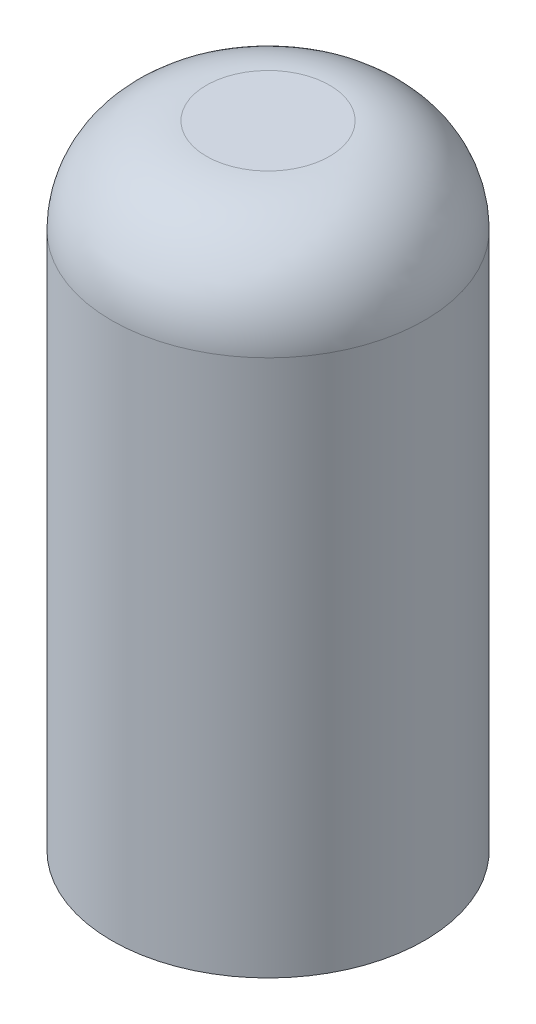
from build123d import *

# Parameters (mm, degrees)
SKETCH1_R           = 4.95
BOSS_EXTRUDE1_DEPTH = 20
FILLET1_R           = 3


with BuildPart() as part:
    # Sketch1 → Boss-Extrude1 (new body)
    with BuildSketch(Plane(origin=(0, 0, 0), x_dir=(1, 0, 0), z_dir=(0, 1, 0))):
        with Locations(Location((0, 0, 0), (0, 0, 270))):
            Circle(SKETCH1_R)
    extrude(amount=BOSS_EXTRUDE1_DEPTH)

    # Fillet1
    fillet1_edges = [part.edges().sort_by_distance(p)[0] for p in [
        (0, 20, -4.95),
    ]]
    fillet(fillet1_edges, radius=FILLET1_R)


solid = part.part
